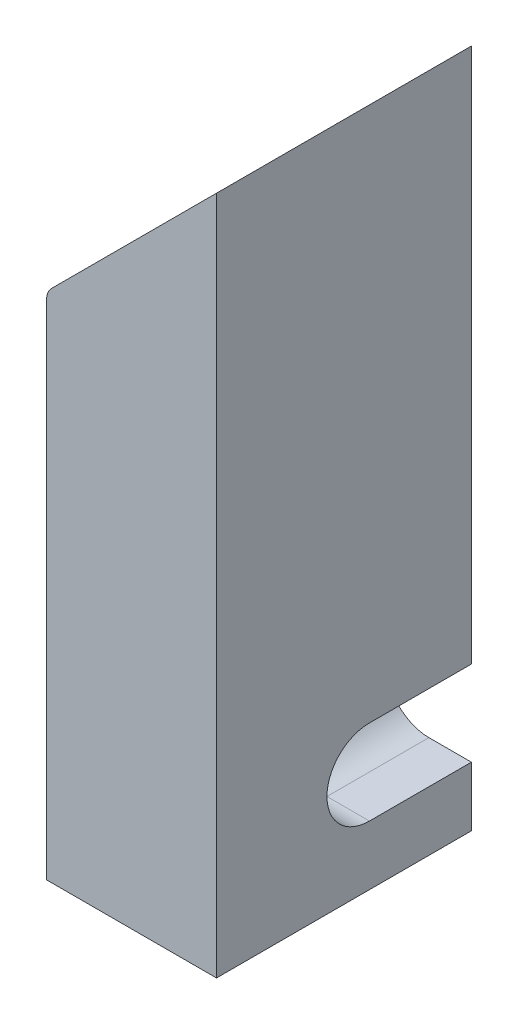
from build123d import *

# Parameters (mm, degrees)
RESSALTO_EXTRUS_O1_DEPTH = 15
ESBO_O2_R                = 2.5
CORTE_EXTRUS_O1_DEPTH    = 44.874821937
ESBO_O3_R                = 2.5
CORTE_EXTRUS_O2_DEPTH    = 6
FILETE1_R                = 1


with BuildPart() as part:
    # Esboço1 → Ressalto-extrusão1 (new body)
    with BuildSketch(Plane.XY):
        Polygon((0, 0), (0, 30), (10, 40), (10, 0), align=None)
    extrude(amount=RESSALTO_EXTRUS_O1_DEPTH)

    # Esboço2 → Corte-extrusão1 (cut, through all)
    with BuildSketch(Plane.ZY):
        with Locations((6, 6)):
            Circle(ESBO_O2_R)
    extrude(amount=-CORTE_EXTRUS_O1_DEPTH, mode=Mode.SUBTRACT)

    # Esboço3 → Corte-extrusão2 (cut)
    with BuildSketch(Plane(origin=(0, 0, 0), x_dir=(-1, 0, 0), z_dir=(0, 0, -1))):
        with BuildLine():
            ThreePointArc((-10, 6.000000001), (-9.267766953, 7.767766953), (-7.5, 8.5))
            Line((-7.5, 8.5), (-10, 8.5))
            Line((-10, 8.5), (-10, 6.000000001))
        make_face()
        with BuildLine():
            ThreePointArc((-7.5, 3.5), (-9.267766953, 4.232233047), (-10, 6.000000001))
            Line((-10, 6.000000001), (-10, 3.5))
            Line((-10, 3.5), (-7.5, 3.5))
        make_face()
        with Locations((-7.5, 6)):
            Circle(ESBO_O3_R)
    extrude(amount=-CORTE_EXTRUS_O2_DEPTH, mode=Mode.SUBTRACT)

    # Filete1
    filete1_edges = [part.edges().sort_by_distance(p)[0] for p in [
        (0, 30, 7.5),
    ]]
    fillet(filete1_edges, radius=FILETE1_R)


solid = part.part
